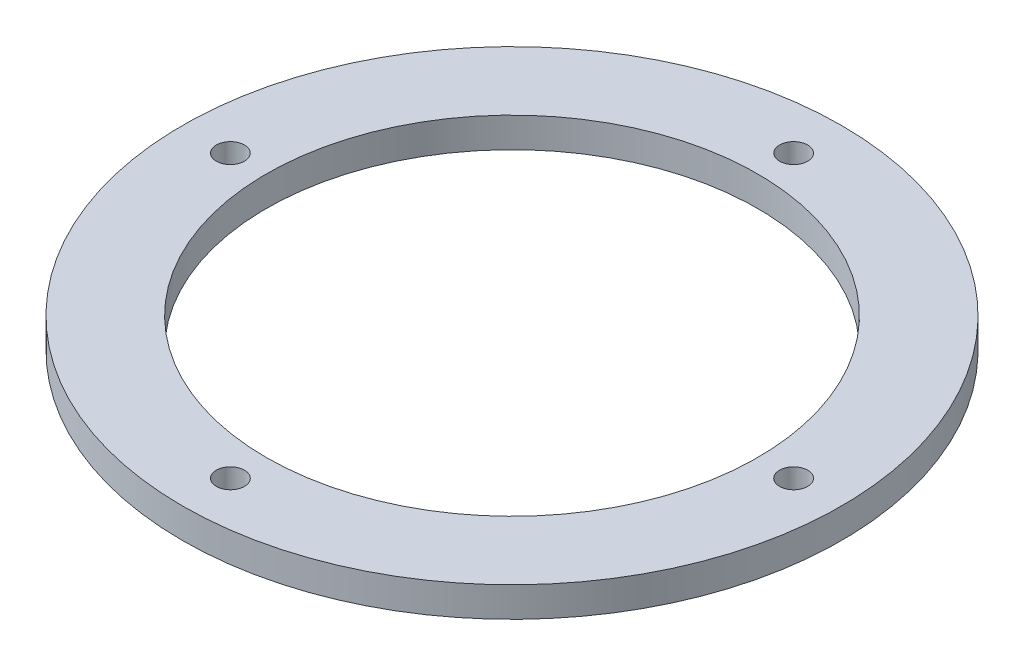
from build123d import *

# Parameters (mm, degrees)
SKETCH_2_R          = 55
SKETCH_2_R_2        = 41
EXTRUDE_1_DEPTH     = 5
SKETCH_5_R          = 2.35
CUT_EXTRUDE_2_DEPTH = 5
FILLET_1_R          = 1


with BuildPart() as part:
    # 草图2 → 凸台-拉伸1 (new body)
    with BuildSketch(Plane(origin=(0, 0, 0), x_dir=(1, 0, 0), z_dir=(0, 1, 0))):
        with Locations(Location((0, 0, 0), (0, 0, 270))):
            Circle(SKETCH_2_R)
        with Locations(Location((0, 0, 0), (0, 0, 270))):
            Circle(SKETCH_2_R_2, mode=Mode.SUBTRACT)
    extrude(amount=EXTRUDE_1_DEPTH)

    # 草图5 → 切除-拉伸2 (cut)
    with BuildSketch(Plane(origin=(0, 0, 0), x_dir=(1, 0, 0), z_dir=(0, 1, 0))):
        with Locations(Location((0, -47, 0), (0, 0, 270))):
            Circle(SKETCH_5_R)
        with Locations(Location((-47, 0, 0), (0, 0, 270))):
            Circle(SKETCH_5_R)
        with Locations(Location((0, 47, 0), (0, 0, 270))):
            Circle(SKETCH_5_R)
        with Locations(Location((47, 0, 0), (0, 0, 270))):
            Circle(SKETCH_5_R)
    extrude(amount=CUT_EXTRUDE_2_DEPTH, mode=Mode.SUBTRACT)

    # 圆角1
    fillet_1_edges = [part.edges().sort_by_distance(p)[0] for p in [
        (0, 0, 44.65),
        (0, 0, -49.35),
        (-47, 0, -2.35),
        (47, 0, -2.35),
    ]]
    fillet(fillet_1_edges, radius=FILLET_1_R)


solid = part.part
